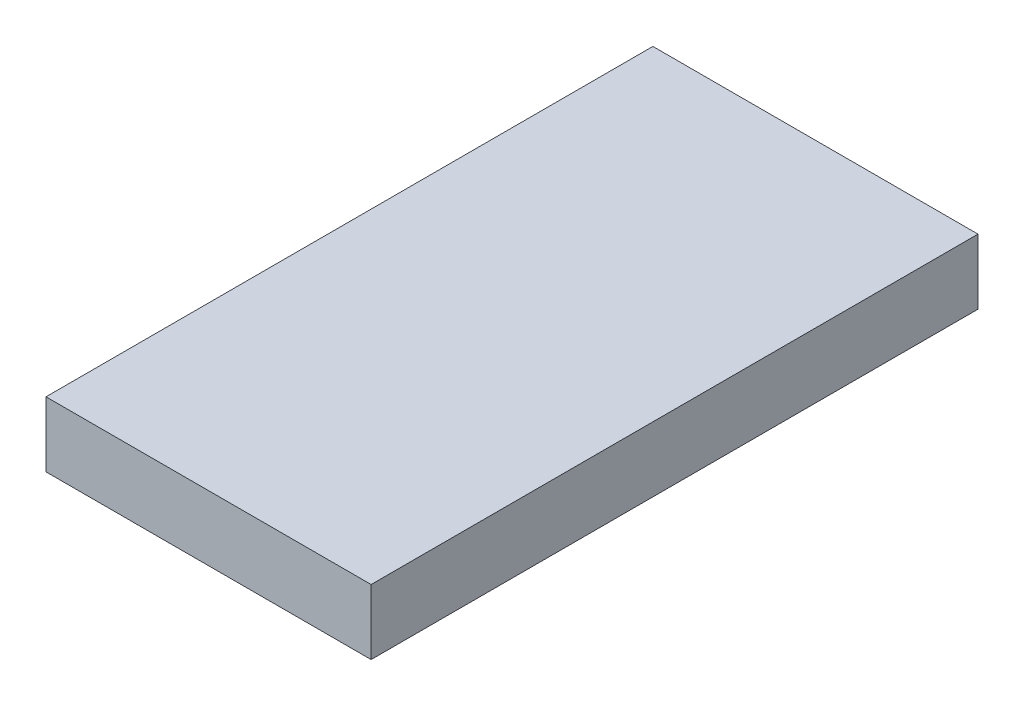
from build123d import *

# Parameters (mm, degrees)
PRENDEDORESB_W = 15
PRENDEDORESB_H = 28
TRAVA_DEPTH    = 3


with BuildPart() as part:
    # PrendedorEsb → Trava (new body)
    with BuildSketch(Plane(origin=(0, 0, 0), x_dir=(1, 0, 0), z_dir=(0, 1, 0))):
        with Locations((7.5, 14)):
            Rectangle(PRENDEDORESB_W, PRENDEDORESB_H)
    extrude(amount=TRAVA_DEPTH)


solid = part.part
